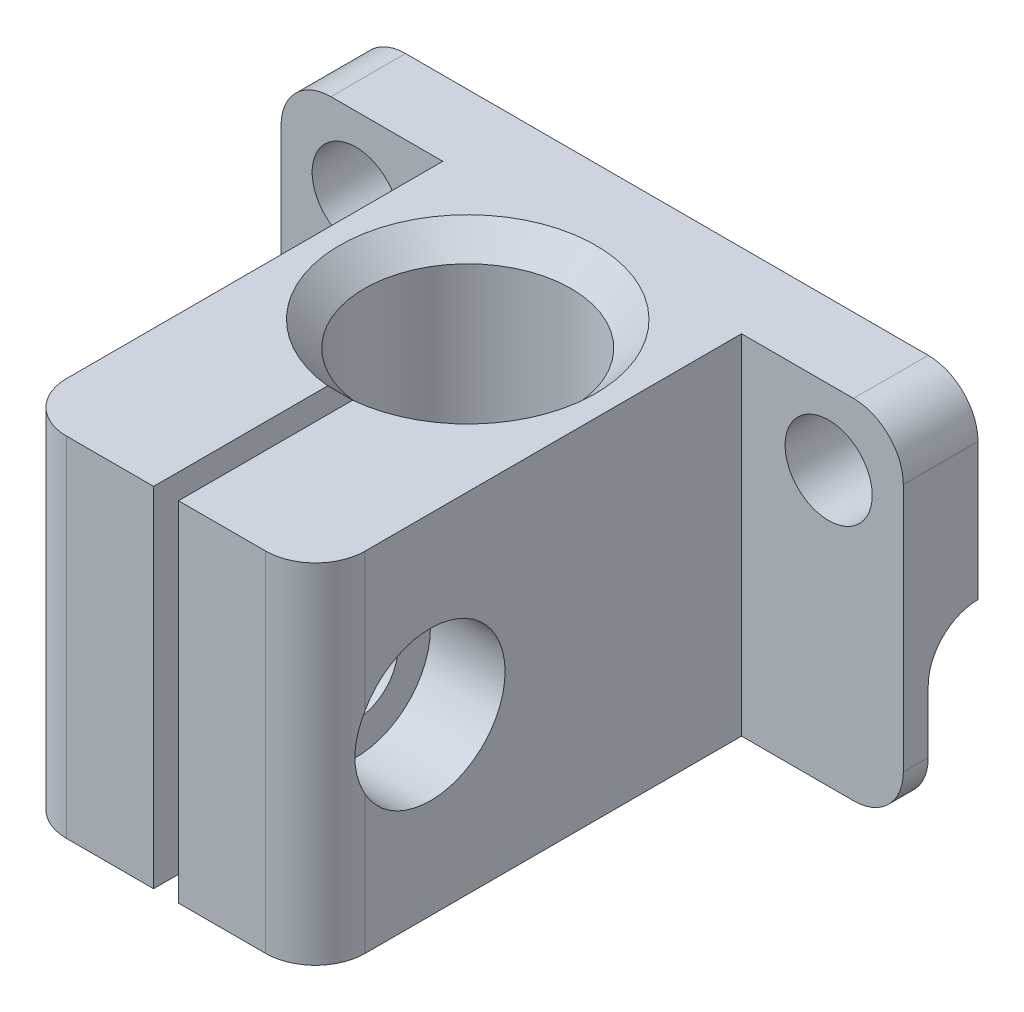
from build123d import *

# Parameters (mm, degrees)
BOSS_EXTRUDE1_DEPTH = 14
CUT_EXTRUDE1_DEPTH  = 28.51465704
CHAMFER1_SIZE       = 1
FILLET1_R           = 2
SKETCH3_R           = 1.75
CUT_EXTRUDE2_DEPTH  = 26.403494878
SKETCH4_R           = 1.7
CUT_EXTRUDE3_DEPTH  = 36.01151742
SKETCH5_R           = 3
CUT_EXTRUDE4_DEPTH  = 3
CUT_EXTRUDE5_DEPTH  = 3


with BuildPart() as part:
    # Sketch1 → Boss-Extrude1 (new body)
    with BuildSketch(Plane(origin=(0, 0, 0), x_dir=(1, 0, 0), z_dir=(0, 1, 0))):
        Polygon((-12.5, 0), (12.5, 0), (12.5, -3), (6, -3), (6, -20.1198), (-6, -20.1198), (-6, -3), (-12.5, -3), align=None)
    extrude(amount=BOSS_EXTRUDE1_DEPTH)

    # Sketch2 → Cut-Extrude1 (cut, through all)
    with BuildSketch(Plane(origin=(0, 14, 0), x_dir=(1, 0, 0), z_dir=(0, 1, 0))):
        with BuildLine():
            Line((-0.5, -12.119769411), (-0.5, -20.1198))
            Line((-0.5, -20.1198), (0.5, -20.1198))
            Line((0.5, -20.1198), (0.5, -12.119769411))
            ThreePointArc((0.5, -12.119769411), (0, -3.85), (-0.5, -12.119769411))
        make_face()
    extrude(amount=-CUT_EXTRUDE1_DEPTH, mode=Mode.SUBTRACT)

    # Chamfer1
    chamfer1_edges = [part.edges().sort_by_distance(p)[0] for p in [
        (0, 0, 3.85),
        (0, 14, 3.85),
    ]]
    chamfer(chamfer1_edges, length=CHAMFER1_SIZE)

    # Fillet1
    fillet1_edges = [part.edges().sort_by_distance(p)[0] for p in [
        (-12.5, 0, 1.5),
        (6, 7, 20.1198),
        (-6, 7, 20.1198),
        (12.5, 14, 1.5),
        (-12.5, 14, 1.5),
        (12.5, 0, 1.5),
    ]]
    fillet(fillet1_edges, radius=FILLET1_R)

    # Sketch3 → Cut-Extrude2 (cut, through all)
    with BuildSketch(Plane.XY.offset(3)):
        with Locations((-9.5, 11)):
            Circle(SKETCH3_R)
        with Locations((9.5, 11)):
            Circle(SKETCH3_R)
    extrude(amount=-CUT_EXTRUDE2_DEPTH, mode=Mode.SUBTRACT)

    # Sketch4 → Cut-Extrude3 (cut, through all)
    with BuildSketch(Plane(origin=(12.5, 0, 0), x_dir=(0, 0, -1), z_dir=(1, 0, 0))):
        with Locations((-15.5, 7)):
            Circle(SKETCH4_R)
        with BuildLine():
            Line((-2, 0), (-2, 4.5))
            ThreePointArc((-2, 4.5), (-1.414213562, 5.914213562), (0, 6.5))
            Line((0, 6.5), (0, 0))
            Line((0, 0), (-2, 0))
        make_face()
    extrude(amount=-CUT_EXTRUDE3_DEPTH, mode=Mode.SUBTRACT)

    # Sketch5 → Cut-Extrude4 (cut)
    with BuildSketch(Plane(origin=(6, 0, 0), x_dir=(0, 0, -1), z_dir=(1, 0, 0))):
        with Locations((-15.5, 7)):
            Circle(SKETCH5_R)
    extrude(amount=-CUT_EXTRUDE4_DEPTH, mode=Mode.SUBTRACT)

    # Sketch6 → Cut-Extrude5 (cut)
    with BuildSketch(Plane.ZY.offset(6)):
        Polygon((15.5, 3.535898385), (18.5, 5.267949192), (18.5, 8.732050808), (15.5, 10.464101615), (12.5, 8.732050808), (12.5, 5.267949192), align=None)
    extrude(amount=-CUT_EXTRUDE5_DEPTH, mode=Mode.SUBTRACT)


solid = part.part
